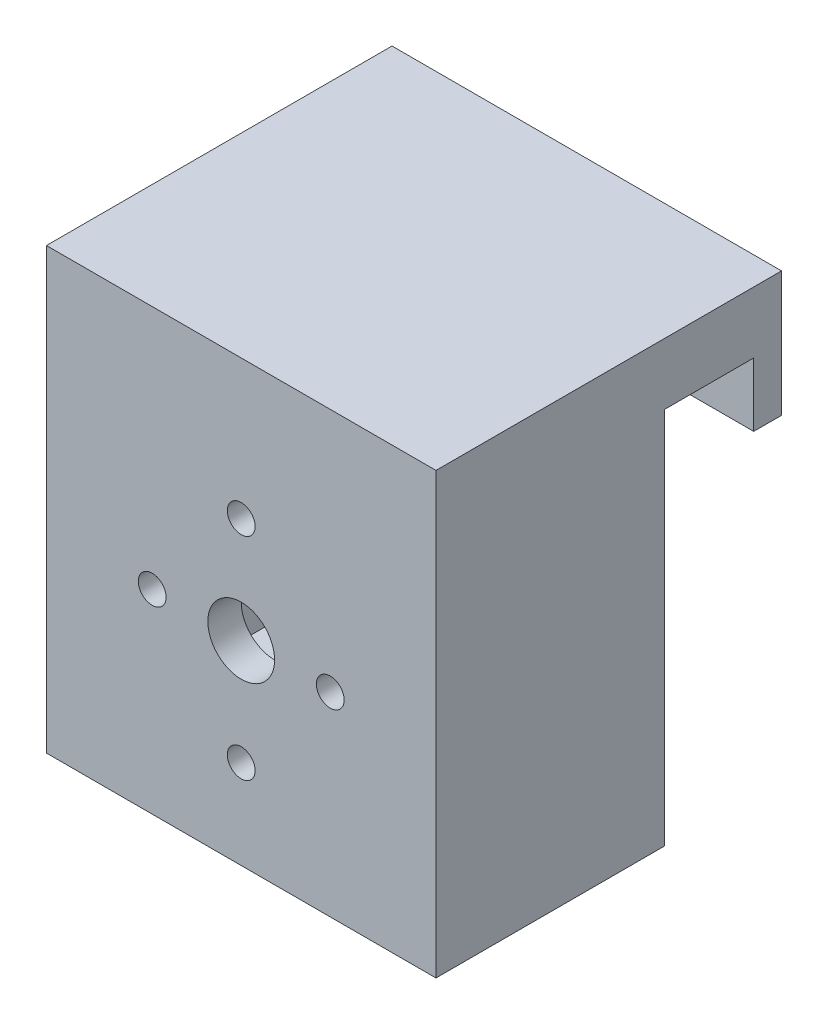
from build123d import *

# Parameters (mm, degrees)
SKETCH1_R           = 1.25
SKETCH1_R_2         = 3
BOSS_EXTRUDE1_DEPTH = 3
SKETCH2_W           = 35
SKETCH2_H           = 39.5
SKETCH2_W_2         = 30
SKETCH2_H_2         = 30
BOSS_EXTRUDE2_DEPTH = 20.55
BOSS_EXTRUDE3_START = -3
SKETCH2_2_W         = 30
SKETCH2_2_H         = 30
BOSS_EXTRUDE3_DEPTH = 3
SKETCH3_W           = 35
SKETCH3_H           = 11.242333622
BOSS_EXTRUDE4_DEPTH = 10.5
CUT_EXTRUDE1_REACH  = 51.958
SKETCH4_W           = 8
SKETCH4_H           = 5.717333622
CUT_EXTRUDE2_START  = -33
CUT_EXTRUDE2_DEPTH  = 31


with BuildPart() as part:
    # Sketch1 → Boss-Extrude1 (new body)
    with BuildSketch(Plane.XY):
        with BuildLine():
            Line((-10.880679664, -4.940982702), (-10.677312396, -4.737615434))
            ThreePointArc((-10.677312396, -4.737615434), (-4.737615434, -4.737615434), (-4.737615434, -10.677312396))
            Line((-4.737615434, -10.677312396), (-4.940982702, -10.880679664))
            ThreePointArc((-4.940982702, -10.880679664), (0, -11.95), (4.940982702, -10.880679664))
            Line((4.940982702, -10.880679664), (4.737615434, -10.677312396))
            ThreePointArc((4.737615434, -10.677312396), (4.737615434, -4.737615434), (10.677312396, -4.737615434))
            Line((10.677312396, -4.737615434), (10.880679664, -4.940982702))
            ThreePointArc((10.880679664, -4.940982702), (11.95, 0), (10.880679664, 4.940982702))
            Line((10.880679664, 4.940982702), (10.677312396, 4.737615434))
            ThreePointArc((10.677312396, 4.737615434), (4.737615434, 4.737615434), (4.737615434, 10.677312396))
            Line((4.737615434, 10.677312396), (4.940982702, 10.880679664))
            ThreePointArc((4.940982702, 10.880679664), (0, 11.95), (-4.940982702, 10.880679664))
            Line((-4.940982702, 10.880679664), (-4.737615434, 10.677312396))
            ThreePointArc((-4.737615434, 10.677312396), (-4.737615434, 4.737615434), (-10.677312396, 4.737615434))
            Line((-10.677312396, 4.737615434), (-10.880679664, 4.940982702))
            ThreePointArc((-10.880679664, 4.940982702), (-11.95, 0), (-10.880679664, -4.940982702))
        make_face()
        with Locations((8, 0)):
            Circle(SKETCH1_R, mode=Mode.SUBTRACT)
        with Locations((0, 9.5)):
            Circle(SKETCH1_R, mode=Mode.SUBTRACT)
        with Locations((0, -9.5)):
            Circle(SKETCH1_R, mode=Mode.SUBTRACT)
        with Locations((-8, 0)):
            Circle(SKETCH1_R, mode=Mode.SUBTRACT)
        Circle(SKETCH1_R_2, mode=Mode.SUBTRACT)
    extrude(amount=BOSS_EXTRUDE1_DEPTH)



with BuildPart() as body_2:
    # Sketch2 → Boss-Extrude2 (new body)
    with BuildSketch(Plane.XY.offset(3)):
        with Locations((0, 2.25)):
            Rectangle(SKETCH2_W, SKETCH2_H)
        Rectangle(SKETCH2_W_2, SKETCH2_H_2, mode=Mode.SUBTRACT)
    extrude(amount=-BOSS_EXTRUDE2_DEPTH)


with BuildPart() as part_1:
    add(part.part)

    add(body_2.part)  # Boss-Extrude3 merges body 2
    # Sketch2<2> → Boss-Extrude3 (add)
    with BuildSketch(Plane.XY.offset(3).offset(BOSS_EXTRUDE3_START)):
        Rectangle(SKETCH2_2_W, SKETCH2_2_H)
        with BuildLine():
            ThreePointArc((-10.880679664, 4.940982702), (-11.95, 0), (-10.880679664, -4.940982702))
            Line((-10.880679664, -4.940982702), (-10.677312396, -4.737615434))
            ThreePointArc((-10.677312396, -4.737615434), (-4.737615434, -4.737615434), (-4.737615434, -10.677312396))
            Line((-4.737615434, -10.677312396), (-4.940982702, -10.880679664))
            ThreePointArc((-4.940982702, -10.880679664), (0, -11.95), (4.940982702, -10.880679664))
            Line((4.940982702, -10.880679664), (4.737615434, -10.677312396))
            ThreePointArc((4.737615434, -10.677312396), (4.737615434, -4.737615434), (10.677312396, -4.737615434))
            Line((10.677312396, -4.737615434), (10.880679664, -4.940982702))
            ThreePointArc((10.880679664, -4.940982702), (11.95, 0), (10.880679664, 4.940982702))
            Line((10.880679664, 4.940982702), (10.677312396, 4.737615434))
            ThreePointArc((10.677312396, 4.737615434), (4.737615434, 4.737615434), (4.737615434, 10.677312396))
            Line((4.737615434, 10.677312396), (4.940982702, 10.880679664))
            ThreePointArc((4.940982702, 10.880679664), (0, 11.95), (-4.940982702, 10.880679664))
            Line((-4.940982702, 10.880679664), (-4.737615434, 10.677312396))
            ThreePointArc((-4.737615434, 10.677312396), (-4.737615434, 4.737615434), (-10.677312396, 4.737615434))
            Line((-10.677312396, 4.737615434), (-10.880679664, 4.940982702))
        make_face(mode=Mode.SUBTRACT)
    extrude(amount=BOSS_EXTRUDE3_DEPTH)

    # Sketch3 → Boss-Extrude4 (add)
    with BuildSketch(Plane(origin=(0, 0, -17.55), x_dir=(-1, 0, 0), z_dir=(0, 0, -1))):
        with Locations((0, 16.378833189)):
            Rectangle(SKETCH3_W, SKETCH3_H)
    extrude(amount=BOSS_EXTRUDE4_DEPTH)

    # Sketch4 → Cut-Extrude1 (cut, up to next)
    with BuildSketch(Plane(origin=(17.5, 0, 0), x_dir=(0, 0, -1), z_dir=(1, 0, 0)), mode=Mode.PRIVATE) as cut_extrude1_sk1:
        with Locations((21.55, 13.616333189)):
            Rectangle(SKETCH4_W, SKETCH4_H)
    cut_extrude1_tool1 = extrude(cut_extrude1_sk1.sketch, amount=-CUT_EXTRUDE1_REACH, mode=Mode.PRIVATE) & part_1.part
    add(cut_extrude1_tool1.solids().sort_by_distance((17.5, 13.616333, -21.55))[0], mode=Mode.SUBTRACT)

    # Sketch4<3> → Cut-Extrude2 (cut)
    with BuildSketch(Plane(origin=(17.5, 0, 0), x_dir=(0, 0, -1), z_dir=(1, 0, 0)).offset(CUT_EXTRUDE2_START)):
        with BuildLine():
            Line((21.55, 17.175), (21.55, 16.475))
            Line((21.55, 16.475), (23.8, 16.475))
            Line((23.8, 16.475), (23.8, 16.975))
            ThreePointArc((23.8, 16.975), (22.900508962, 17.969936153), (21.820204103, 17.175))
            Line((21.820204103, 17.175), (21.55, 17.175))
        make_face()
        with BuildLine():
            Line((19.3, 16.975), (19.3, 16.475))
            Line((19.3, 16.475), (21.55, 16.475))
            Line((21.55, 16.475), (21.55, 17.175))
            Line((21.55, 17.175), (21.279795897, 17.175))
            ThreePointArc((21.279795897, 17.175), (20.199491038, 17.969936153), (19.3, 16.975))
        make_face()
    extrude(amount=CUT_EXTRUDE2_DEPTH, mode=Mode.SUBTRACT)


solid = part_1.part
